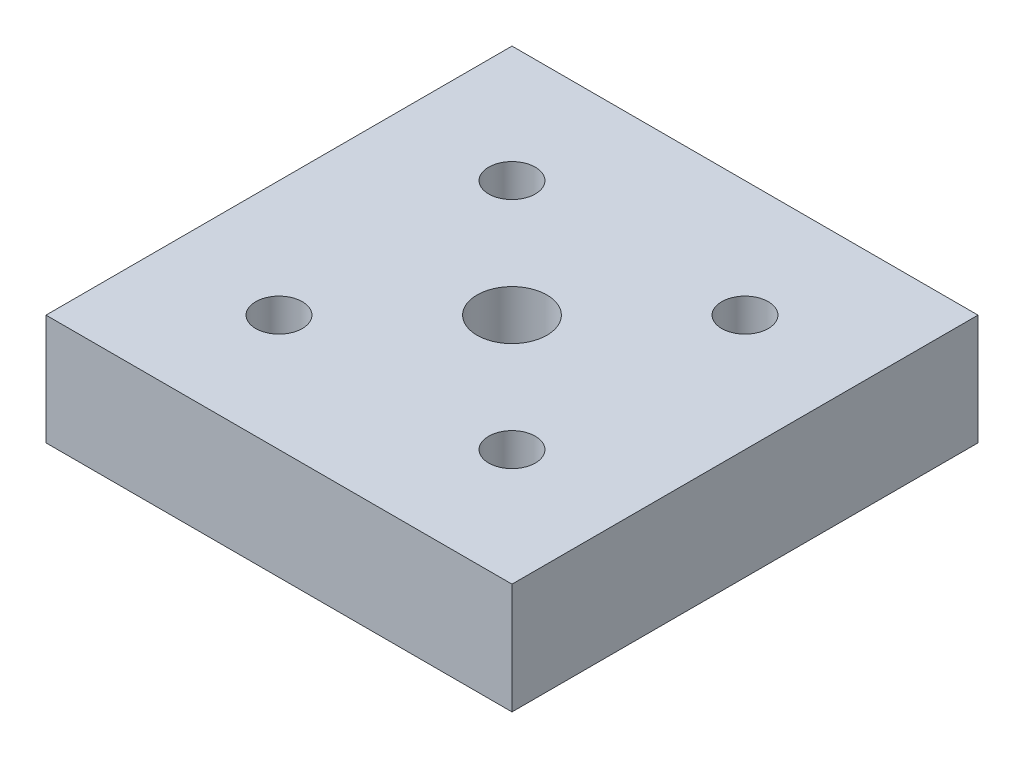
from build123d import *

# Parameters (mm, degrees)
SKETCH1_W           = 80
SKETCH1_H           = 80
SKETCH1_R           = 4
SKETCH1_R_2         = 6
BOSS_EXTRUDE1_DEPTH = 19
SKETCH2_R           = 7
CUT_EXTRUDE1_DEPTH  = 8


with BuildPart() as part:
    # Sketch1 → Boss-Extrude1 (new body)
    with BuildSketch(Plane(origin=(0, 0, 0), x_dir=(1, 0, 0), z_dir=(0, 1, 0))):
        Rectangle(SKETCH1_W, SKETCH1_H)
        with Locations(Location((-20, 20, 0), (0, 0, 270))):
            Circle(SKETCH1_R, mode=Mode.SUBTRACT)
        with Locations(Location((20, 20, 0), (0, 0, 270))):
            Circle(SKETCH1_R, mode=Mode.SUBTRACT)
        with Locations(Location((20, -20, 0), (0, 0, 270))):
            Circle(SKETCH1_R, mode=Mode.SUBTRACT)
        with Locations(Location((-20, -20, 0), (0, 0, 270))):
            Circle(SKETCH1_R, mode=Mode.SUBTRACT)
        with Locations(Location((0, 0, 0), (0, 0, 270))):
            Circle(SKETCH1_R_2, mode=Mode.SUBTRACT)
    extrude(amount=BOSS_EXTRUDE1_DEPTH)

    # Sketch2 → Cut-Extrude1 (cut)
    with BuildSketch(Plane(origin=(0, 0, 0), x_dir=(1, 0, 0), z_dir=(0, 1, 0))):
        with Locations(Location((-20, 20, 0), (0, 0, 270))):
            Circle(SKETCH2_R)
        with Locations(Location((20, 20, 0), (0, 0, 270))):
            Circle(SKETCH2_R)
        with Locations(Location((20, -20, 0), (0, 0, 270))):
            Circle(SKETCH2_R)
        with Locations(Location((-20, -20, 0), (0, 0, 270))):
            Circle(SKETCH2_R)
    extrude(amount=CUT_EXTRUDE1_DEPTH, mode=Mode.SUBTRACT)


solid = part.part
